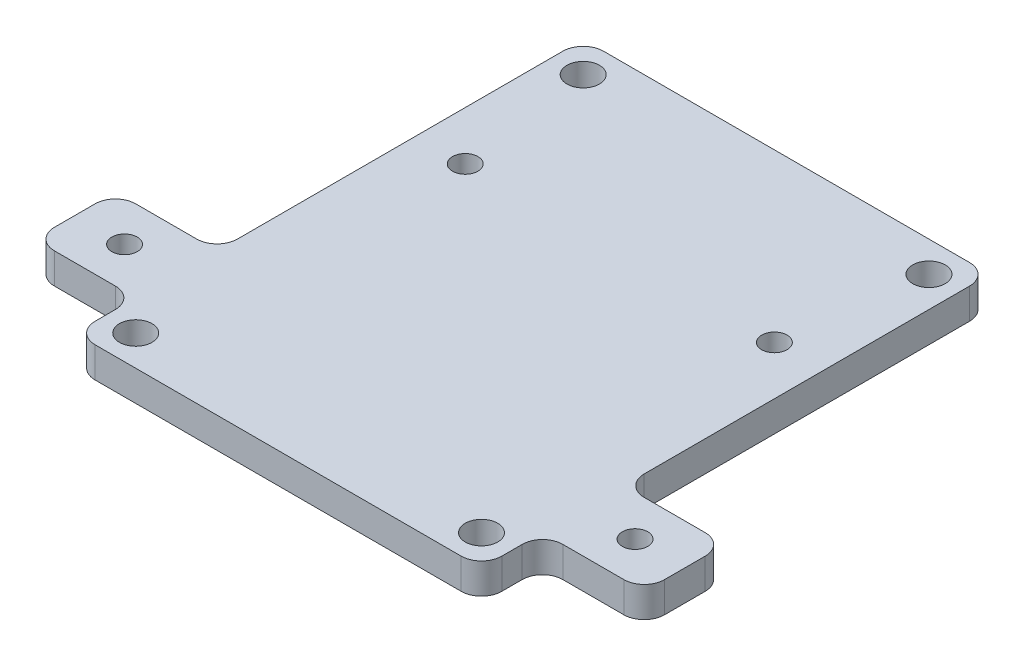
from build123d import *

# Parameters (mm, degrees)
EXTRUDE_1_DEPTH     = 3
EXTRUDE_2_DEPTH     = 3
SKETCH_2_R          = 1.25
CUT_EXTRUDE_1_DEPTH = 3
SKETCH_3_R          = 1.6
CUT_EXTRUDE_2_DEPTH = 3
FILLET_1_R          = 2


with BuildPart() as part:
    # 草图1 → 凸台-拉伸1 (new body)
    with BuildSketch(Plane(origin=(0, 0, 0), x_dir=(1, 0, 0), z_dir=(0, 1, 0))):
        with BuildLine():
            Line((-18, 25), (18, 25))
            ThreePointArc((18, 25), (19.414213562, 24.414213562), (20, 23))
            Line((20, 23), (20, -23))
            ThreePointArc((20, -23), (19.414213562, -24.414213562), (18, -25))
            Line((18, -25), (-18, -25))
            ThreePointArc((-18, -25), (-19.414213562, -24.414213562), (-20, -23))
            Line((-20, -23), (-20, 23))
            ThreePointArc((-20, 23), (-19.414213562, 24.414213562), (-18, 25))
        make_face()
    extrude(amount=EXTRUDE_1_DEPTH)

    # 草图4 → 凸台-拉伸2 (add)
    with BuildSketch(Plane(origin=(0, 3, 0), x_dir=(1, 0, 0), z_dir=(0, 1, 0))):
        with BuildLine():
            Line((-28, -11), (28, -11))
            ThreePointArc((28, -11), (29.414213562, -11.585786438), (30, -13))
            Line((30, -13), (30, -17))
            ThreePointArc((30, -17), (29.414213562, -18.414213562), (28, -19))
            Line((28, -19), (-28, -19))
            ThreePointArc((-28, -19), (-29.414213562, -18.414213562), (-30, -17))
            Line((-30, -17), (-30, -13))
            ThreePointArc((-30, -13), (-29.414213562, -11.585786438), (-28, -11))
        make_face()
    extrude(amount=-EXTRUDE_2_DEPTH)

    # 草图2 → 切除-拉伸1 (cut)
    with BuildSketch(Plane(origin=(0, 3, 0), x_dir=(1, 0, 0), z_dir=(0, 1, 0))):
        with Locations(Location((-25.1, -15, 0), (0, 0, 270))):
            Circle(SKETCH_2_R)
        with Locations(Location((-15.2, 8.6, 0), (0, 0, 270))):
            Circle(SKETCH_2_R)
        with Locations(Location((15.2, 8.6, 0), (0, 0, 90))):
            Circle(SKETCH_2_R)
        with Locations(Location((25.1, -15, 0), (0, 0, 90))):
            Circle(SKETCH_2_R)
    extrude(amount=-CUT_EXTRUDE_1_DEPTH, mode=Mode.SUBTRACT)

    # 草图3 → 切除-拉伸2 (cut)
    with BuildSketch(Plane(origin=(0, 3, 0), x_dir=(1, 0, 0), z_dir=(0, 1, 0))):
        with Locations(Location((-17, 22, 0), (0, 0, 270))):
            Circle(SKETCH_3_R)
        with Locations(Location((-17, -22, 0), (0, 0, 90))):
            Circle(SKETCH_3_R)
        with Locations(Location((17, -22, 0), (0, 0, 270))):
            Circle(SKETCH_3_R)
        with Locations(Location((17, 22, 0), (0, 0, 90))):
            Circle(SKETCH_3_R)
    extrude(amount=-CUT_EXTRUDE_2_DEPTH, mode=Mode.SUBTRACT)

    # 圆角1
    fillet_1_edges = [part.edges().sort_by_distance(p)[0] for p in [
        (-20, 1.5, 11),
        (20, 1.5, 11),
        (-20, 1.5, 19),
        (20, 1.5, 19),
    ]]
    fillet(fillet_1_edges, radius=FILLET_1_R)


solid = part.part
